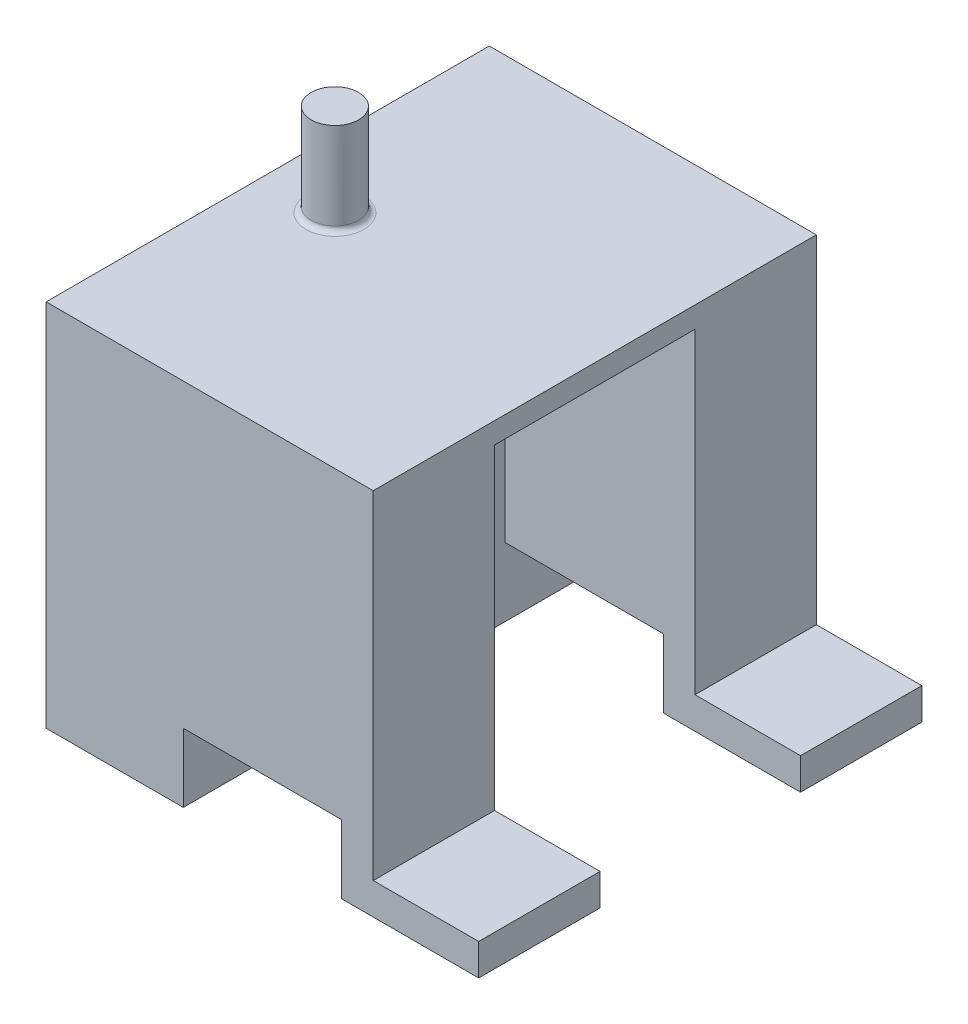
from build123d import *

# Parameters (mm, degrees)
BOSS_EXTRUDE1_DEPTH = 42
CUT_EXTRUDE1_REACH  = 70.337
SKETCH2_W           = 19
SKETCH2_H           = 33
SKETCH3_R           = 2.25
BOSS_EXTRUDE2_DEPTH = 8.75
FILLET1_R           = 0.5


with BuildPart() as part:
    # Sketch1 → Boss-Extrude1 (new body)
    with BuildSketch(Plane.XY):
        Polygon((19.580645161, 0), (19.580645161, 6.5), (4.580645161, 6.5), (4.580645161, 0), (-8.419354839, 0), (-8.419354839, 3), (-8.419354839, 35), (1.580645161, 35), (22.580645161, 35), (22.580645161, 3), (32.580645161, 3), (32.580645161, 0), align=None)
    extrude(amount=BOSS_EXTRUDE1_DEPTH)

    # Cut-Extrude1: up to this face of the body (flat: up to its plane)
    cut_extrude1_end = Plane(part.part.faces().sort_by_distance((4.580645161, 3.25, 21))[0])
    # Sketch2 → Cut-Extrude1 (cut, up to the picked face)
    with BuildSketch(Plane(origin=(32.580645161, 0, 0), x_dir=(0, 0, -1), z_dir=(1, 0, 0)), mode=Mode.PRIVATE) as cut_extrude1_sk1:
        with Locations((-21, 16.5)):
            Rectangle(SKETCH2_W, SKETCH2_H)
    cut_extrude1_tool1 = split(extrude(cut_extrude1_sk1.sketch, amount=-CUT_EXTRUDE1_REACH, mode=Mode.PRIVATE), bisect_by=cut_extrude1_end, keep=Keep.BOTH, mode=Mode.PRIVATE)
    add(cut_extrude1_tool1.solids().sort_by(Axis((32.580645, 16.5, 21), (-1, 0, 0)))[0], mode=Mode.SUBTRACT)

    # Sketch3 → Boss-Extrude2 (add)
    with BuildSketch(Plane(origin=(0, 35, 0), x_dir=(1, 0, 0), z_dir=(0, 1, 0))):
        with Locations(Location((-2.051707365, -21, 0), (0, 0, 90))):
            Circle(SKETCH3_R)
    extrude(amount=BOSS_EXTRUDE2_DEPTH)

    # Fillet1
    fillet1_edges = [part.edges().sort_by_distance(p)[0] for p in [
        (-2.051707365, 35, 23.25),
    ]]
    fillet(fillet1_edges, radius=FILLET1_R)


solid = part.part
